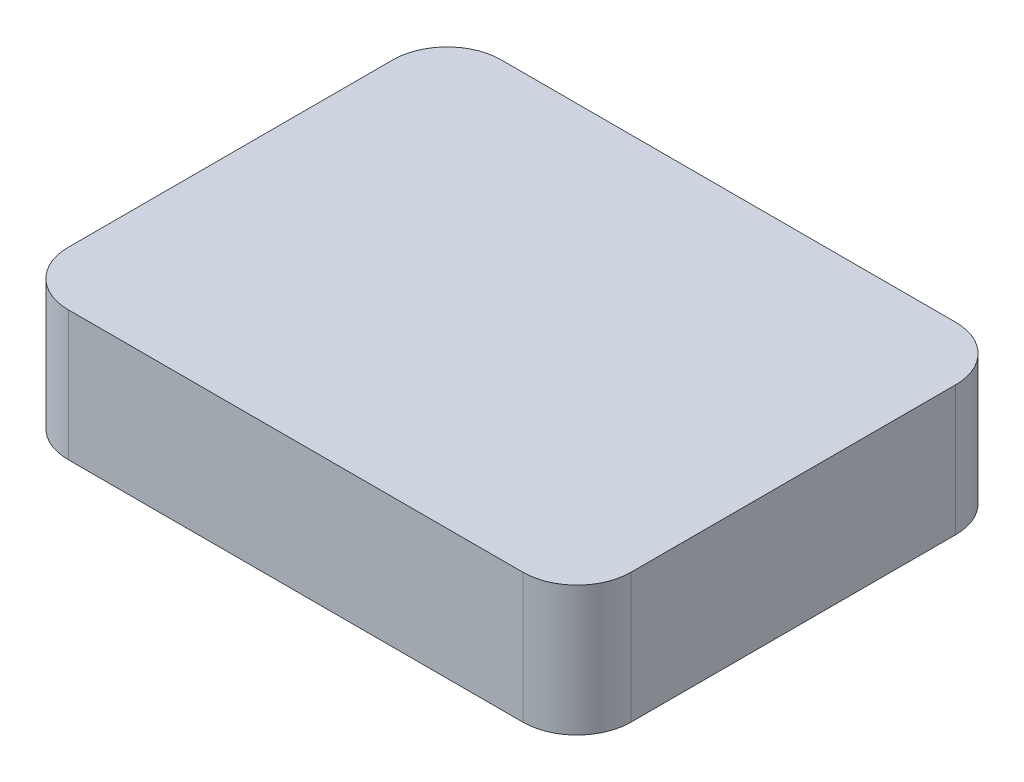
from build123d import *

# Parameters (mm, degrees)
SKETCH_1_W      = 52
SKETCH_1_H      = 40
EXTRUDE_1_DEPTH = 12
FILLET_1_R      = 5


with BuildPart() as part:
    # 草图1 → 凸台-拉伸1 (new body)
    with BuildSketch(Plane(origin=(0, 0, 0), x_dir=(1, 0, 0), z_dir=(0, 1, 0))):
        Rectangle(SKETCH_1_W, SKETCH_1_H)
    extrude(amount=EXTRUDE_1_DEPTH)

    # 圆角1
    fillet_1_edges = [part.edges().sort_by_distance(p)[0] for p in [
        (-26, 6, -20),
        (26, 6, -20),
        (26, 6, 20),
        (-26, 6, 20),
    ]]
    fillet(fillet_1_edges, radius=FILLET_1_R)


solid = part.part
